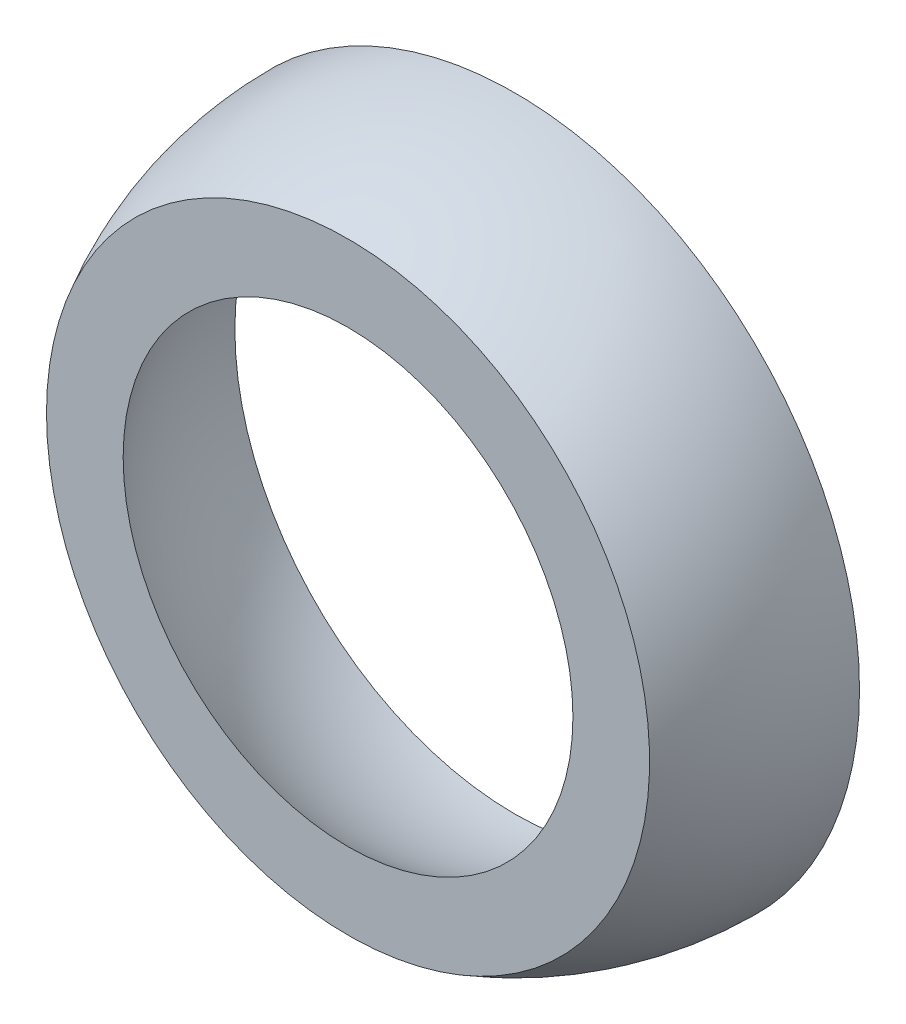
from build123d import *

# Parameters (mm, degrees)
CORTE_EXTRUS_O1_DEPTH      = 28.712812921
CORTE_EXTRUS_O1_DEPTH_BACK = 28.712812921
ESBO_O2_W                  = 8.254033308
ESBO_O2_H                  = 28


with BuildPart() as part:
    # Esboço1 → Revolução1 (revolve)
    with BuildSketch(Plane(origin=(0, 0, 0), x_dir=(0, 0, -1), z_dir=(1, 0, 0)), mode=Mode.PRIVATE) as revolu_o1_sk:
        with BuildLine():
            Line((-16, 0), (-13, 0))
            ThreePointArc((-13, 0), (-9.192388155, 9.192388155), (0, 13))
            Line((0, 13), (0, 16))
            ThreePointArc((0, 16), (-11.313708499, 11.313708499), (-16, 0))
        make_face()
    revolve(revolu_o1_sk.sketch.rotate(Axis((0, 0, 16), (0, 0, -1)), 180), axis=Axis((0, 0, 16), (0, 0, -1)))

    # Esboço2 → Corte-extrusão1 (cut, two sides: drawn at the far end of the back side and taken through both)
    with BuildSketch(Plane(origin=(0, 0, 0), x_dir=(0, 0, -1), z_dir=(1, 0, 0)).offset(-CORTE_EXTRUS_O1_DEPTH_BACK)):
        with Locations((-11.872983346, 0)):
            Rectangle(ESBO_O2_W, ESBO_O2_H)
    extrude(amount=CORTE_EXTRUS_O1_DEPTH + CORTE_EXTRUS_O1_DEPTH_BACK, mode=Mode.SUBTRACT)


solid = part.part
